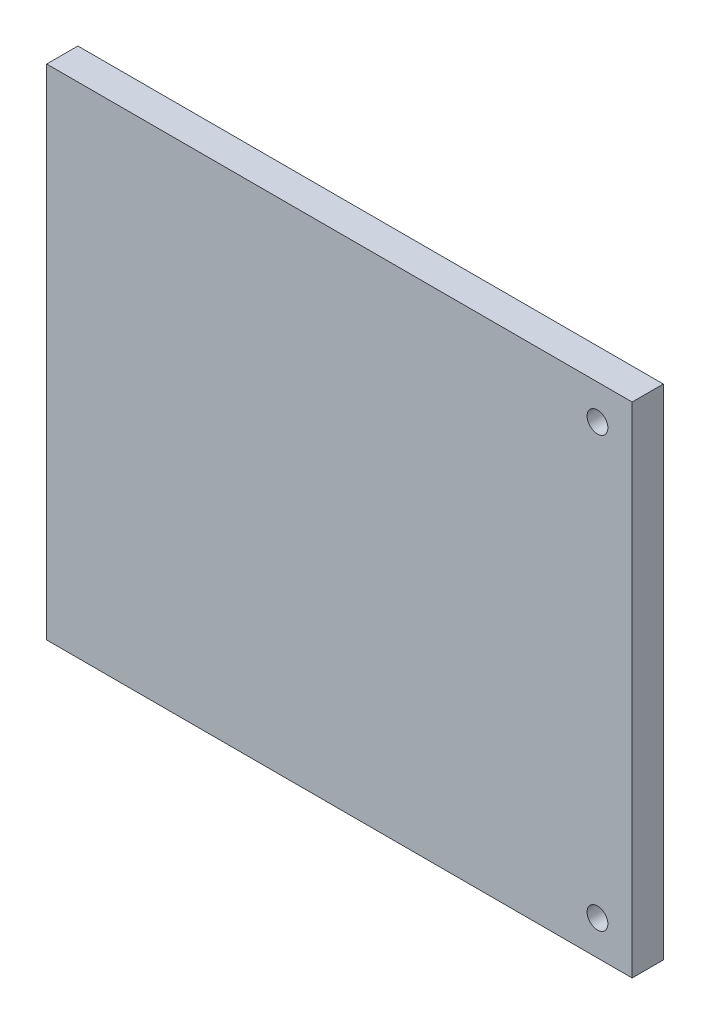
from build123d import *

# Parameters (mm, degrees)
SKETCH1_W           = 84.5
SKETCH1_H           = 72
BOSS_EXTRUDE1_DEPTH = 4.5
SKETCH2_R           = 1.5
CUT_EXTRUDE1_DEPTH  = 56.689428979


with BuildPart() as part:
    # Sketch1 → Boss-Extrude1 (new body)
    with BuildSketch(Plane.XY):
        Rectangle(SKETCH1_W, SKETCH1_H)
    extrude(amount=BOSS_EXTRUDE1_DEPTH)

    # Sketch2 → Cut-Extrude1 (cut, through all)
    with BuildSketch(Plane(origin=(0, 0, 0), x_dir=(-1, 0, 0), z_dir=(0, 0, -1))):
        with Locations((-37.25, 31)):
            Circle(SKETCH2_R)
        with Locations((-37.25, -31)):
            Circle(SKETCH2_R)
    extrude(amount=-CUT_EXTRUDE1_DEPTH, mode=Mode.SUBTRACT)


solid = part.part
